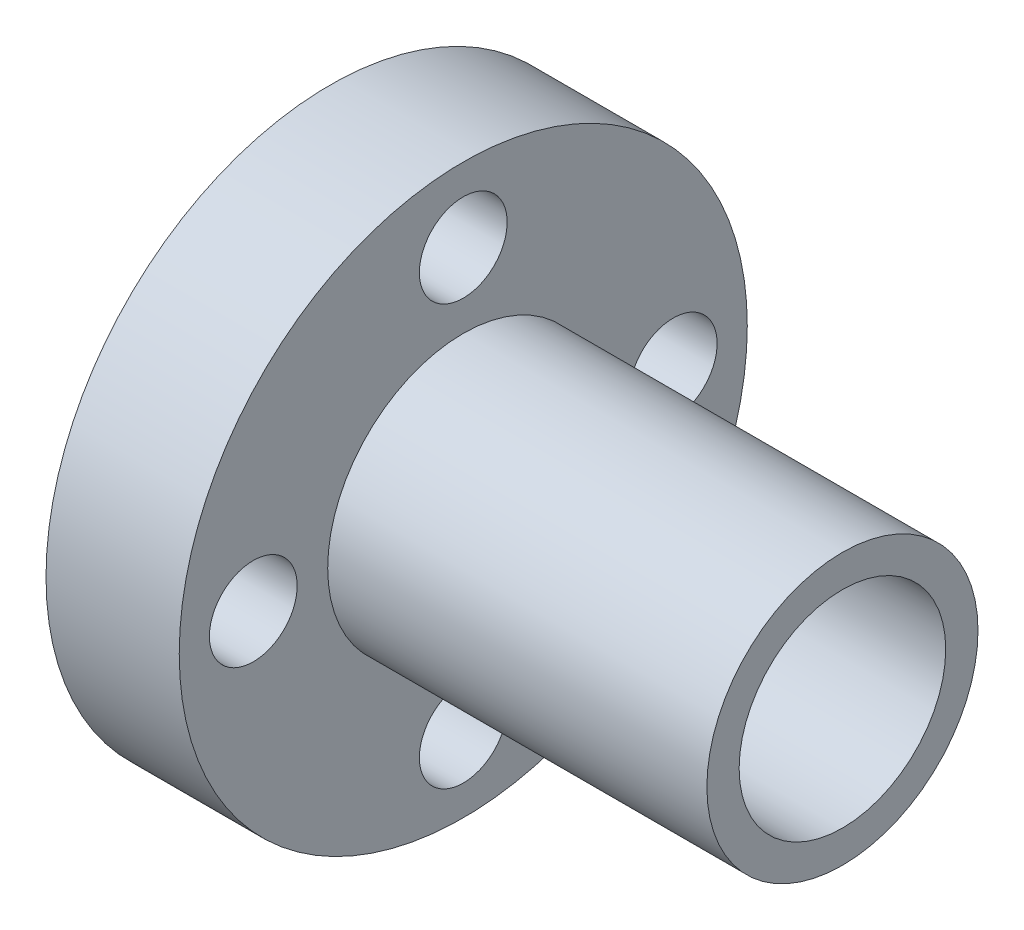
from build123d import *

# Parameters (mm, degrees)
SKETCH4_R           = 11
BOSS_EXTRUDE2_DEPTH = 5.159375
SKETCH5_R           = 5.25
BOSS_EXTRUDE3_DEPTH = 19.84375
SKETCH6_R           = 1.7
CUT_EXTRUDE1_DEPTH  = 5.159375
CIRPATTERN2_COUNT   = 4
SKETCH8_R           = 4.0005
CUT_EXTRUDE3_DEPTH  = 26.214567497


with BuildPart() as part:
    # Sketch4 → Boss-Extrude2 (new body)
    with BuildSketch(Plane(origin=(0, 0, 0), x_dir=(0, 0, -1), z_dir=(1, 0, 0))):
        Circle(SKETCH4_R)
    extrude(amount=BOSS_EXTRUDE2_DEPTH)

    # Sketch5 → Boss-Extrude3 (add)
    with BuildSketch(Plane.ZY):
        Circle(SKETCH5_R)
    extrude(amount=-BOSS_EXTRUDE3_DEPTH)

    # Sketch6 → Cut-Extrude1 (cut)
    with BuildSketch(Plane(origin=(0, 0, 0), x_dir=(0, 0, -1), z_dir=(1, 0, 0))):
        with Locations(Location((0, 8.1315, 0), (0, 0, 180))):
            Circle(SKETCH6_R)
    cut_extrude1 = extrude(amount=CUT_EXTRUDE1_DEPTH, mode=Mode.SUBTRACT)

    # CirPattern2: Cut-Extrude1 ×4 about axis
    cirpattern2_axis = Axis((0, 0, 0), (1, 0, 0))
    for i in range(1, CIRPATTERN2_COUNT):
        add(cut_extrude1.rotate(cirpattern2_axis, i * 360 / CIRPATTERN2_COUNT), mode=Mode.SUBTRACT)

    # Sketch8 → Cut-Extrude3 (cut, through all)
    with BuildSketch(Plane(origin=(19.84375, 0, 0), x_dir=(0, 0, -1), z_dir=(1, 0, 0))):
        Circle(SKETCH8_R)
    extrude(amount=-CUT_EXTRUDE3_DEPTH, mode=Mode.SUBTRACT)


solid = part.part
